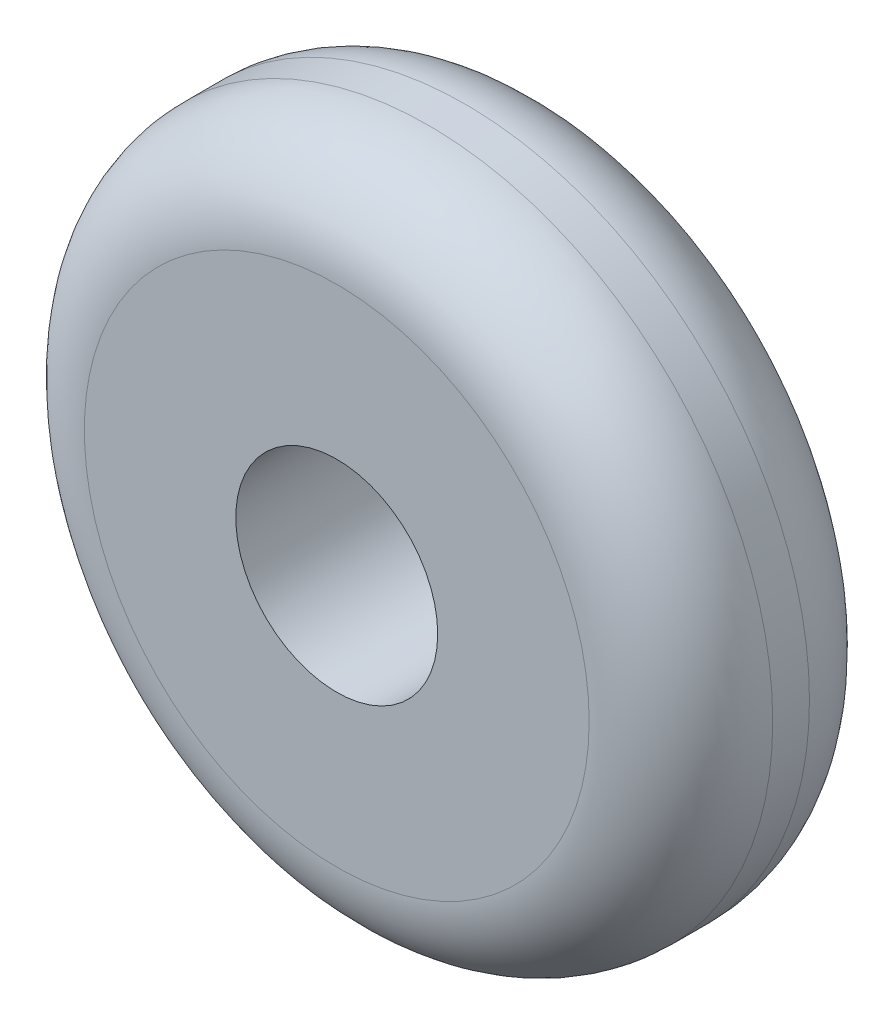
from build123d import *

# Parameters (mm, degrees)
SKETCH_1_R      = 37.5
SKETCH_1_R_2    = 11
EXTRUDE_1_DEPTH = 24
FILLET_1_R      = 10


with BuildPart() as part:
    # 草图1 → 凸台-拉伸1 (new body)
    with BuildSketch(Plane.XY):
        Circle(SKETCH_1_R)
        Circle(SKETCH_1_R_2, mode=Mode.SUBTRACT)
    extrude(amount=EXTRUDE_1_DEPTH)

    # 圆角1
    fillet_1_edges = [part.edges().sort_by_distance(p)[0] for p in [
        (-37.5, 0, 0),
        (-37.5, 0, 24),
    ]]
    fillet(fillet_1_edges, radius=FILLET_1_R)


solid = part.part
